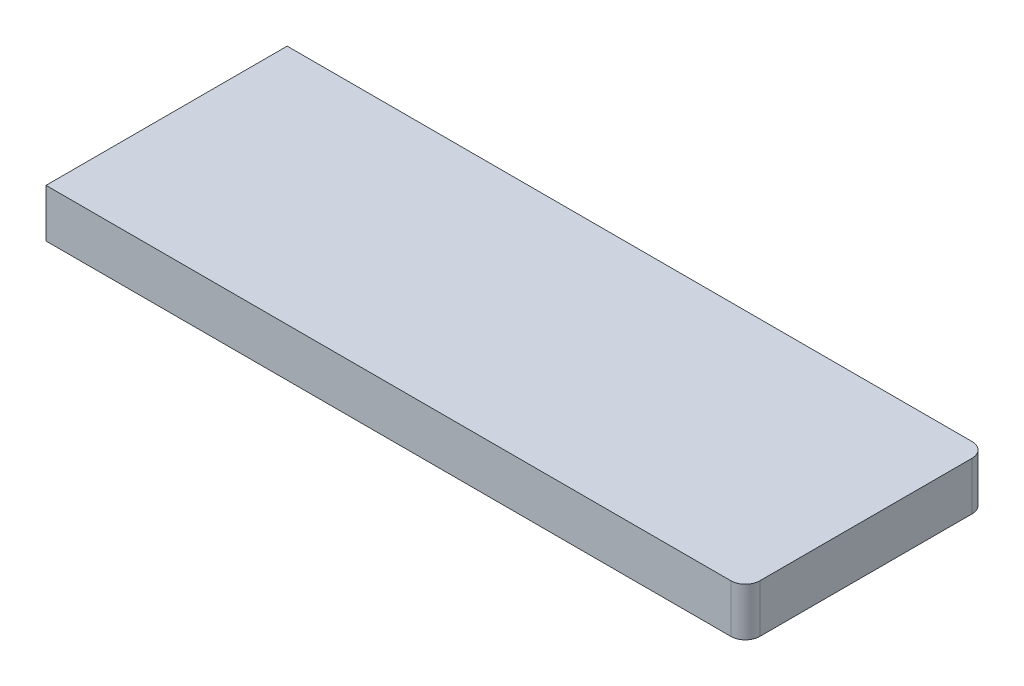
from build123d import *

# Parameters (mm, degrees)
SKETCH1_W           = 145
SKETCH1_H           = 50
BOSS_EXTRUDE1_DEPTH = 10
FILLET1_R           = 3


with BuildPart() as part:
    # Sketch1 → Boss-Extrude1 (new body)
    with BuildSketch(Plane(origin=(0, 0, 0), x_dir=(1, 0, 0), z_dir=(0, 1, 0))):
        Rectangle(SKETCH1_W, SKETCH1_H)
    extrude(amount=BOSS_EXTRUDE1_DEPTH)

    # Fillet1
    fillet1_edges = [part.edges().sort_by_distance(p)[0] for p in [
        (72.5, 5, 25),
        (72.5, 5, -25),
    ]]
    fillet(fillet1_edges, radius=FILLET1_R)


solid = part.part
